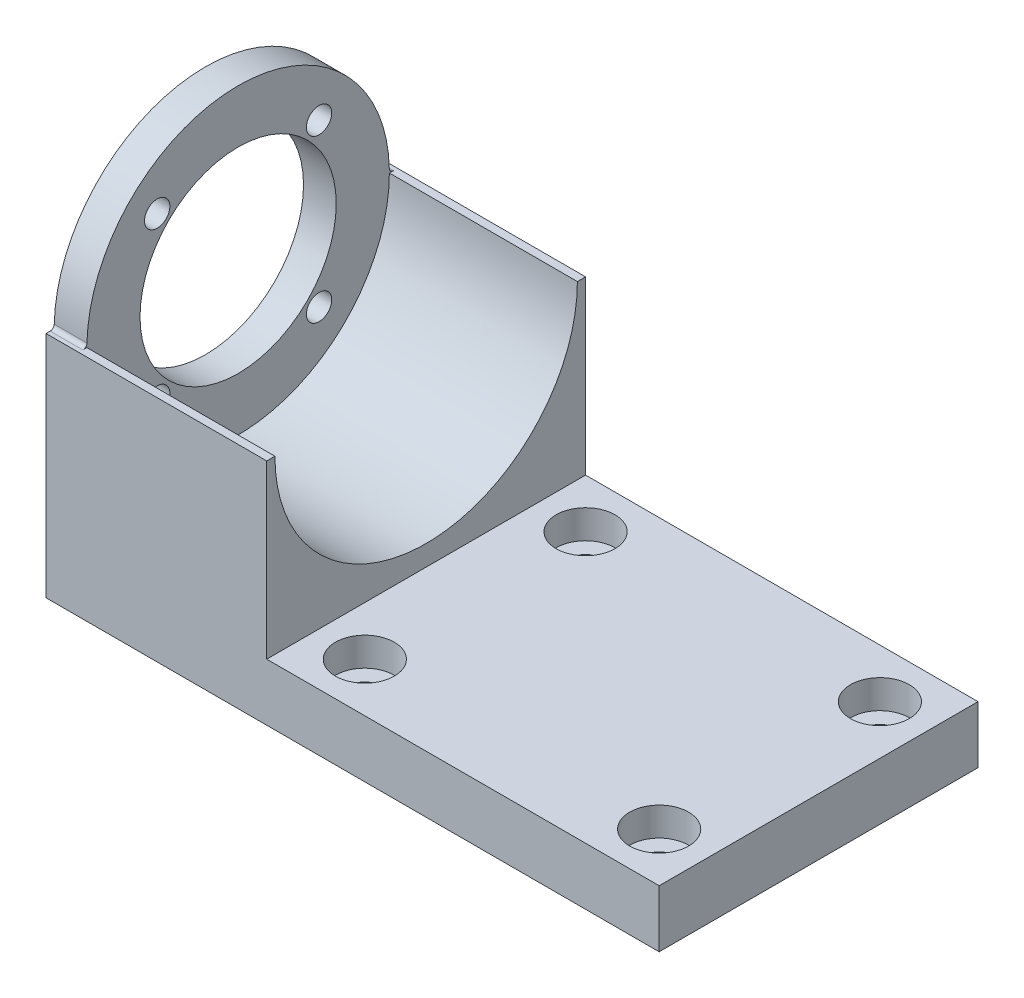
from build123d import *

# Parameters (mm, degrees)
ESBO_O1_R                = 18.5
ESBO_O1_R_2              = 12
RESSALTO_EXTRUS_O1_DEPTH = 4
RESSALTO_EXTRUS_O2_DEPTH = 27
FILETE1_R                = 0.5
ESBO_O3_W                = 39
ESBO_O3_H                = 7
RESSALTO_EXTRUS_O3_DEPTH = 75
ESBO_O4_R                = 1.55
CORTE_EXTRUS_O1_DEPTH    = 7
ESBO_O5_R                = 3.6
CORTE_EXTRUS_O2_DEPTH    = 3.5
ESBO_O6_R                = 1.55
CORTE_EXTRUS_O4_DEPTH    = 4


with BuildPart() as part:
    # Esboço1 → Ressalto-extrusão1 (new body)
    with BuildSketch(Plane(origin=(0, 0, 0), x_dir=(0, 0, -1), z_dir=(1, 0, 0))):
        Circle(ESBO_O1_R)
        Circle(ESBO_O1_R_2, mode=Mode.SUBTRACT)
    extrude(amount=RESSALTO_EXTRUS_O1_DEPTH)

    # Esboço2 → Ressalto-extrusão2 (add)
    with BuildSketch(Plane.ZY):
        with BuildLine():
            Line((-19.5, 0), (-19.5, -21))
            Line((-19.5, -21), (19.5, -21))
            Line((19.5, -21), (19.5, 0))
            Line((19.5, 0), (18.5, 0))
            ThreePointArc((18.5, 0), (0, -18.5), (-18.5, 0))
            Line((-18.5, 0), (-19.5, 0))
        make_face()
    extrude(amount=-RESSALTO_EXTRUS_O2_DEPTH)

    # Filete1
    filete1_edges = [part.edges().sort_by_distance(p)[0] for p in [
        (2, 0, 18.5),
        (2, 0, -18.5),
    ]]
    fillet(filete1_edges, radius=FILETE1_R)

    # Esboço3 → Ressalto-extrusão3 (add)
    with BuildSketch(Plane.ZY):
        with Locations((0, -24.5)):
            Rectangle(ESBO_O3_W, ESBO_O3_H)
    extrude(amount=-RESSALTO_EXTRUS_O3_DEPTH)

    # Esboço4 → Corte-extrusão1 (cut)
    with BuildSketch(Plane(origin=(0, -21, 0), x_dir=(1, 0, 0), z_dir=(0, 1, 0))):
        with Locations(Location((33, 13.5, 0), (0, 0, 270))):
            Circle(ESBO_O4_R)
        with Locations(Location((69, 13.5, 0), (0, 0, 270))):
            Circle(ESBO_O4_R)
        with Locations(Location((33, -13.5, 0), (0, 0, 270))):
            Circle(ESBO_O4_R)
        with Locations(Location((69, -13.5, 0), (0, 0, 270))):
            Circle(ESBO_O4_R)
    extrude(amount=-CORTE_EXTRUS_O1_DEPTH, mode=Mode.SUBTRACT)

    # Esboço5 → Corte-extrusão2 (cut)
    with BuildSketch(Plane(origin=(0, -21, 0), x_dir=(1, 0, 0), z_dir=(0, 1, 0))):
        with Locations(Location((33, 13.5, 0), (0, 0, 270))):
            Circle(ESBO_O5_R)
        with Locations(Location((69, 13.5, 0), (0, 0, 270))):
            Circle(ESBO_O5_R)
        with Locations(Location((69, -13.5, 0), (0, 0, 270))):
            Circle(ESBO_O5_R)
        with Locations(Location((33, -13.5, 0), (0, 0, 270))):
            Circle(ESBO_O5_R)
    extrude(amount=-CORTE_EXTRUS_O2_DEPTH, mode=Mode.SUBTRACT)

    # Esboço6 → Corte-extrusão4 (cut)
    with BuildSketch(Plane.ZY):
        with Locations(Location((9.899494937, 9.899494937, 0), (0, 0, 180))):
            Circle(ESBO_O6_R)
        with Locations(Location((9.899494937, -9.899494937, 0), (0, 0, 180))):
            Circle(ESBO_O6_R)
        with Locations(Location((-9.899494937, -9.899494937, 0), (0, 0, 180))):
            Circle(ESBO_O6_R)
        with Locations(Location((-9.899494937, 9.899494937, 0), (0, 0, 180))):
            Circle(ESBO_O6_R)
    extrude(amount=-CORTE_EXTRUS_O4_DEPTH, mode=Mode.SUBTRACT)


solid = part.part
